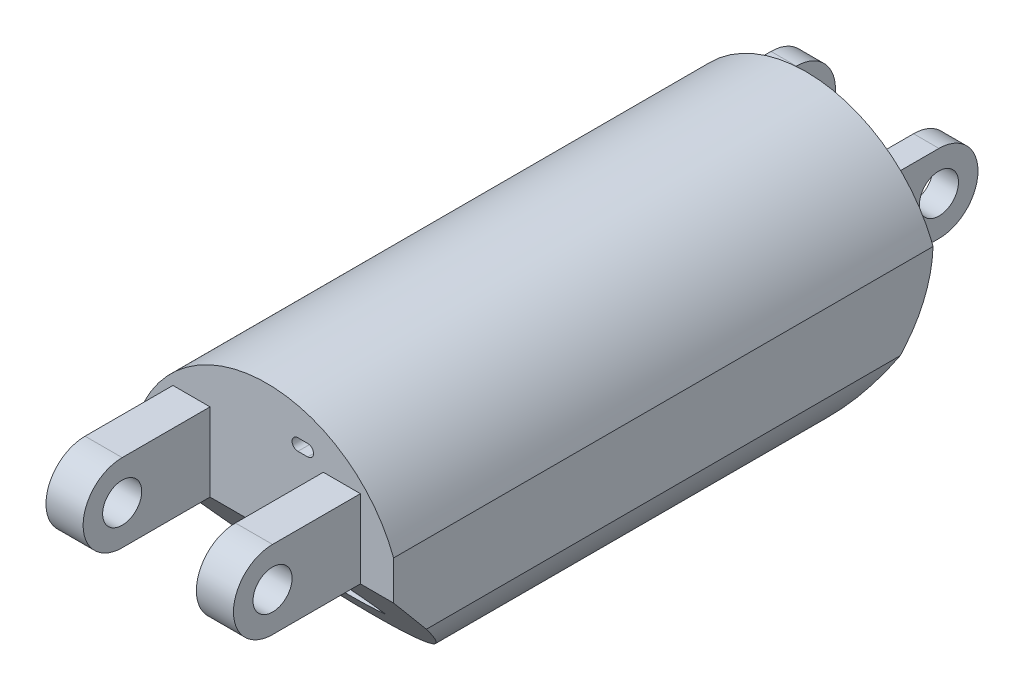
from build123d import *

# Parameters (mm, degrees)
BOSS_EXTRUDE1_DEPTH       = 17.541875
CUT_EXTRUDE1_DEPTH        = 27.39752836
CUT_EXTRUDE2_DEPTH        = 41.248995504
SKETCH4_R                 = 1.27
BOSS_EXTRUDE2_DEPTH       = 0.635
SKETCH5_R                 = 1.27
BOSS_EXTRUDE3_DEPTH       = 1.27
MIRROR2_COPY_1_SKETCH_R   = 1.27
MIRROR2_COPY_1_DEPTH      = 0.635
MIRROR2_COPY_2_SKETCH_R   = 1.27
MIRROR2_COPY_2_DEPTH      = 1.27
SKETCH6_R                 = 1.27
CUT_EXTRUDE3_DEPTH        = 0.635
SKETCH7_R                 = 1.27
BOSS_EXTRUDE4_DEPTH       = 0.381
MIRROR4_COPY_1_SKETCH_R   = 1.27
MIRROR4_COPY_1_DEPTH      = 0.635
MIRROR4_COPY_2_SKETCH_R   = 1.27
MIRROR4_COPY_2_DEPTH      = 0.381
BOSS_EXTRUDE8_DEPTH       = 2.286
BOSS_EXTRUDE9_START       = -2.286
BOSS_EXTRUDE9_DEPTH       = 2.286
CUT_EXTRUDE13_DEPTH       = 3.81
CUT_EXTRUDE13_DEPTH_BACK  = 3.81
SKETCH30_R                = 1.27
SKETCH31_R                = 1.27
BOSS_EXTRUDE17_DEPTH      = 1.27
CUT_EXTRUDE14_DEPTH       = 17.78
FILLET1_R                 = 7.62
BOSS_EXTRUDE18_DEPTH      = 6.096
BOSS_EXTRUDE18_DEPTH_BACK = 6.096
SKETCH33_R                = 1.27
SKETCH34_W                = 7.366
SKETCH34_H                = 5.915462339
CUT_EXTRUDE15_DEPTH       = 46.317216729
CUT_EXTRUDE16_DEPTH       = 32.431862668
CUT_EXTRUDE16_DEPTH_BACK  = 32.431862668
SKETCH35_R                = 1.27
SKETCH36_W                = 0.284935897
SKETCH36_H                = 2.320192308
CUT_EXTRUDE17_DEPTH       = 1
CUT_EXTRUDE18_DEPTH       = 22.86


with BuildPart() as part:
    # Sketch1 → Boss-Extrude1 (new, symmetric)
    with BuildSketch(Plane.XY):
        with BuildLine():
            Line((0, 0), (0, 5.08))
            ThreePointArc((0, 5.08), (8.255, 10.795), (16.51, 5.08))
            Line((16.51, 5.08), (16.51, 0))
            ThreePointArc((16.51, 0), (8.255, -5.715), (0, 0))
        make_face()
    extrude(amount=BOSS_EXTRUDE1_DEPTH, both=True)

    # Sketch2 → Cut-Extrude1 (cut, through all)
    with BuildSketch(Plane(origin=(0, 0, 0), x_dir=(0, 0, -1), z_dir=(1, 0, 0))):
        Polygon((17.541875, -5.715), (10.615107545, -5.715), (17.541875, 2.54), align=None)
        Polygon((-17.541875, 2.54), (-17.541875, -5.715), (-10.615107545, -5.715), align=None)
    extrude(amount=CUT_EXTRUDE1_DEPTH, mode=Mode.SUBTRACT)

    # Sketch3 → Cut-Extrude2 (cut, through all)
    with BuildSketch(Plane.XY.offset(17.541875)):
        with BuildLine():
            ThreePointArc((5.27906494, -2.991291811), (8.322471529, -3.631916692), (11.365878119, -2.991291811))
            ThreePointArc((11.365878119, -2.991291811), (8.322471529, -0.720891905), (5.27906494, -2.991291811))
        make_face()
    extrude(amount=-CUT_EXTRUDE2_DEPTH, mode=Mode.SUBTRACT)

    # Sketch4 → Boss-Extrude2 (add, symmetric)
    with BuildSketch(Plane(origin=(11.43, 0, 0), x_dir=(0, 0, -1), z_dir=(1, 0, 0))):
        with BuildLine():
            Line((-17.541875, 7.62), (-20.716875, 7.62))
            ThreePointArc((-20.716875, 7.62), (-23.256875, 5.08), (-20.716875, 2.54))
            Line((-20.716875, 2.54), (-17.541875, 2.54))
            Line((-17.541875, 2.54), (-17.541875, 7.62))
        make_face()
        with Locations((-20.716875, 5.08)):
            Circle(SKETCH4_R, mode=Mode.SUBTRACT)
    boss_extrude2 = extrude(amount=BOSS_EXTRUDE2_DEPTH, both=True)

    # Sketch5 → Boss-Extrude3 (add)
    with BuildSketch(Plane.ZY.offset(-10.795)):
        with BuildLine():
            Line((17.541875, 7.62), (17.541875, 2.54))
            Line((17.541875, 2.54), (20.716875, 2.54))
            ThreePointArc((20.716875, 2.54), (23.256875, 5.08), (20.716875, 7.62))
            Line((20.716875, 7.62), (17.541875, 7.62))
        make_face()
        with Locations((20.716875, 5.08)):
            Circle(SKETCH5_R, mode=Mode.SUBTRACT)
    boss_extrude3 = extrude(amount=BOSS_EXTRUDE3_DEPTH)

    # Mirror1: Boss-Extrude2, Boss-Extrude3 across plane
    add(boss_extrude2.mirror(Plane(origin=(8.255, 0, 0), x_dir=(0, 0, 1), z_dir=(1, 0, 0))))
    add(boss_extrude3.mirror(Plane(origin=(8.255, 0, 0), x_dir=(0, 0, 1), z_dir=(1, 0, 0))))

    # Mirror2: Boss-Extrude2, Boss-Extrude3 across plane
    add(boss_extrude2.mirror(Plane.XY))
    add(boss_extrude3.mirror(Plane.XY))

    # Mirror2 copy 1 sketch → Mirror2 copy 1 (add, symmetric)
    with BuildSketch(Plane.ZY.offset(-5.08)):
        with BuildLine():
            Line((-17.541875, 7.62), (-20.716875, 7.62))
            ThreePointArc((-20.716875, 7.62), (-23.256875, 5.08), (-20.716875, 2.54))
            Line((-20.716875, 2.54), (-17.541875, 2.54))
            Line((-17.541875, 2.54), (-17.541875, 7.62))
        make_face()
        with Locations((-20.716875, 5.08)):
            Circle(MIRROR2_COPY_1_SKETCH_R, mode=Mode.SUBTRACT)
    extrude(amount=MIRROR2_COPY_1_DEPTH, both=True)

    # Mirror2 copy 2 sketch → Mirror2 copy 2 (add)
    with BuildSketch(Plane(origin=(5.715, 0, 0), x_dir=(0, 0, -1), z_dir=(1, 0, 0))):
        with BuildLine():
            Line((17.541875, 7.62), (17.541875, 2.54))
            Line((17.541875, 2.54), (20.716875, 2.54))
            ThreePointArc((20.716875, 2.54), (23.256875, 5.08), (20.716875, 7.62))
            Line((20.716875, 7.62), (17.541875, 7.62))
        make_face()
        with Locations((20.716875, 5.08)):
            Circle(MIRROR2_COPY_2_SKETCH_R, mode=Mode.SUBTRACT)
    extrude(amount=MIRROR2_COPY_2_DEPTH)

    # Sketch6 → Cut-Extrude3 (cut)
    with BuildSketch(Plane.ZY.offset(-9.525)):
        with BuildLine():
            Line((20.716875, 7.62), (17.541875, 7.62))
            Line((17.541875, 7.62), (17.541875, 2.54))
            Line((17.541875, 2.54), (20.716875, 2.54))
            ThreePointArc((20.716875, 2.54), (23.256875, 5.08), (20.716875, 7.62))
        make_face()
        with Locations((20.716875, 5.08)):
            Circle(SKETCH6_R, mode=Mode.SUBTRACT)
    cut_extrude3 = extrude(amount=-CUT_EXTRUDE3_DEPTH, mode=Mode.SUBTRACT)

    # Sketch7 → Boss-Extrude4 (add)
    with BuildSketch(Plane(origin=(12.065, 0, 0), x_dir=(0, 0, -1), z_dir=(1, 0, 0))):
        with BuildLine():
            Line((-17.541875, 2.54), (-17.541875, 7.62))
            Line((-17.541875, 7.62), (-20.716875, 7.62))
            ThreePointArc((-20.716875, 7.62), (-23.256875, 5.08), (-20.716875, 2.54))
            Line((-20.716875, 2.54), (-17.541875, 2.54))
        make_face()
        with Locations(Location((-20.716875, 5.08, 0), (0, 0, 180))):
            Circle(SKETCH7_R, mode=Mode.SUBTRACT)
    boss_extrude4 = extrude(amount=BOSS_EXTRUDE4_DEPTH)

    # Mirror3: Cut-Extrude3, Boss-Extrude4 across plane
    add(cut_extrude3.mirror(Plane(origin=(8.255, 0, 0), x_dir=(0, 0, 1), z_dir=(1, 0, 0))), mode=Mode.SUBTRACT)
    add(boss_extrude4.mirror(Plane(origin=(8.255, 0, 0), x_dir=(0, 0, 1), z_dir=(1, 0, 0))))

    # Mirror4: Cut-Extrude3, Boss-Extrude4 across plane
    add(cut_extrude3.mirror(Plane.XY), mode=Mode.SUBTRACT)
    add(boss_extrude4.mirror(Plane.XY))

    # Mirror4 copy 1 sketch → Mirror4 copy 1 (cut)
    with BuildSketch(Plane(origin=(6.985, 0, 0), x_dir=(0, 0, -1), z_dir=(1, 0, 0))):
        with BuildLine():
            Line((20.716875, 7.62), (17.541875, 7.62))
            Line((17.541875, 7.62), (17.541875, 2.54))
            Line((17.541875, 2.54), (20.716875, 2.54))
            ThreePointArc((20.716875, 2.54), (23.256875, 5.08), (20.716875, 7.62))
        make_face()
        with Locations((20.716875, 5.08)):
            Circle(MIRROR4_COPY_1_SKETCH_R, mode=Mode.SUBTRACT)
    extrude(amount=-MIRROR4_COPY_1_DEPTH, mode=Mode.SUBTRACT)

    # Mirror4 copy 2 sketch → Mirror4 copy 2 (add)
    with BuildSketch(Plane.ZY.offset(-4.445)):
        with BuildLine():
            Line((-17.541875, 2.54), (-17.541875, 7.62))
            Line((-17.541875, 7.62), (-20.716875, 7.62))
            ThreePointArc((-20.716875, 7.62), (-23.256875, 5.08), (-20.716875, 2.54))
            Line((-20.716875, 2.54), (-17.541875, 2.54))
        make_face()
        with Locations(Location((-20.716875, 5.08, 0), (0, 0, 180))):
            Circle(MIRROR4_COPY_2_SKETCH_R, mode=Mode.SUBTRACT)
    extrude(amount=MIRROR4_COPY_2_DEPTH)

    # Sketch13 → Boss-Extrude8 (add)
    with BuildSketch(Plane(origin=(12.446, 0, 0), x_dir=(0, 0, -1), z_dir=(1, 0, 0))):
        with BuildLine():
            Line((-17.541875, 7.62), (-23.256875, 7.62))
            ThreePointArc((-23.256875, 7.62), (-25.796875, 5.08), (-23.256875, 2.54))
            Line((-23.256875, 2.54), (-17.541875, 2.54))
            Line((-17.541875, 2.54), (-17.541875, 7.62))
        make_face()
    extrude(amount=-BOSS_EXTRUDE8_DEPTH)

    # Sketch14 → Boss-Extrude9 (add)
    with BuildSketch(Plane.ZY.offset(-4.064).offset(BOSS_EXTRUDE9_START)):
        with BuildLine():
            Line((17.541875, 7.62), (17.541875, 2.54))
            Line((17.541875, 2.54), (23.256875, 2.54))
            ThreePointArc((23.256875, 2.54), (25.796875, 5.08), (23.256875, 7.62))
            Line((23.256875, 7.62), (17.541875, 7.62))
        make_face()
    extrude(amount=BOSS_EXTRUDE9_DEPTH)

    # Sketch30 → Cut-Extrude13 (cut, two sides: drawn at the far end of the back side and taken through both)
    with BuildSketch(Plane(origin=(8.255, 0, 0), x_dir=(0, 0, -1), z_dir=(1, 0, 0)).offset(-CUT_EXTRUDE13_DEPTH_BACK)):
        with BuildLine():
            Line((17.541875, 2.54), (20.716875, 2.54))
            ThreePointArc((20.716875, 2.54), (23.256875, 5.08), (20.716875, 7.62))
            Line((20.716875, 7.62), (17.541875, 7.62))
            Line((17.541875, 7.62), (17.541875, 2.54))
        make_face()
        with Locations((20.716875, 5.08)):
            Circle(SKETCH30_R, mode=Mode.SUBTRACT)
    extrude(amount=CUT_EXTRUDE13_DEPTH + CUT_EXTRUDE13_DEPTH_BACK, mode=Mode.SUBTRACT)

    # Sketch31 → Boss-Extrude17 (add)
    with BuildSketch(Plane(origin=(12.446, 0, 0), x_dir=(0, 0, -1), z_dir=(1, 0, 0))):
        with BuildLine():
            Line((17.541875, 2.54), (20.716875, 2.54))
            ThreePointArc((20.716875, 2.54), (23.256875, 5.08), (20.716875, 7.62))
            Line((20.716875, 7.62), (17.541875, 7.62))
            Line((17.541875, 7.62), (17.541875, 2.54))
        make_face()
        with Locations((20.716875, 5.08)):
            Circle(SKETCH31_R, mode=Mode.SUBTRACT)
    boss_extrude17 = extrude(amount=BOSS_EXTRUDE17_DEPTH)

    # Mirror11: Boss-Extrude17 across plane
    add(boss_extrude17.mirror(Plane(origin=(8.255, 0, 0), x_dir=(0, 0, 1), z_dir=(1, 0, 0))))

    # Sketch32 → Cut-Extrude14 (cut)
    with BuildSketch(Plane(origin=(0, 0, -17.541875), x_dir=(-1, 0, 0), z_dir=(0, 0, -1))):
        with BuildLine():
            Line((-6.223, 7.9756), (-5.588, 7.9756))
            ThreePointArc((-5.588, 7.9756), (-5.207, 8.3566), (-5.588, 8.7376))
            Line((-5.588, 8.7376), (-6.223, 8.7376))
            ThreePointArc((-6.223, 8.7376), (-6.604, 8.3566), (-6.223, 7.9756))
        make_face()
    extrude(amount=-CUT_EXTRUDE14_DEPTH, mode=Mode.SUBTRACT)

    # Fillet1
    fillet1_edges = [part.edges().sort_by_distance(p)[0] for p in [
        (1.397, 2.54, -17.541875),
        (15.113, 2.54, -17.541875),
    ]]
    fillet(fillet1_edges, radius=FILLET1_R)

    # Sketch33 → Boss-Extrude18 (add, two sides: drawn at the far end of the back side and taken through both)
    with BuildSketch(Plane(origin=(8.255, 0, 0), x_dir=(0, 0, -1), z_dir=(1, 0, 0)).offset(-BOSS_EXTRUDE18_DEPTH_BACK)):
        with BuildLine():
            Line((-23.256875, 2.54), (-17.541875, 2.54))
            Line((-17.541875, 2.54), (-17.541875, 7.62))
            Line((-17.541875, 7.62), (-23.256875, 7.62))
            ThreePointArc((-23.256875, 7.62), (-25.796875, 5.08), (-23.256875, 2.54))
        make_face()
        with Locations(Location((-23.256875, 5.08, 0), (0, 0, 180))):
            Circle(SKETCH33_R, mode=Mode.SUBTRACT)
    extrude(amount=BOSS_EXTRUDE18_DEPTH + BOSS_EXTRUDE18_DEPTH_BACK)

    # Sketch34 → Cut-Extrude15 (cut, through all)
    with BuildSketch(Plane.XY.offset(17.541875)):
        with Locations((8.255, 4.662268831)):
            Rectangle(SKETCH34_W, SKETCH34_H)
    extrude(amount=CUT_EXTRUDE15_DEPTH, mode=Mode.SUBTRACT)

    # Sketch35 → Cut-Extrude16 (cut, two sides: drawn at the far end of the back side and taken through both)
    with BuildSketch(Plane(origin=(14.351, 0, 0), x_dir=(0, 0, -1), z_dir=(1, 0, 0)).offset(-CUT_EXTRUDE16_DEPTH_BACK)):
        with Locations(Location((-23.256875, 5.08, 0), (0, 0, 180))):
            Circle(SKETCH35_R)
    extrude(amount=CUT_EXTRUDE16_DEPTH + CUT_EXTRUDE16_DEPTH_BACK, mode=Mode.SUBTRACT)

    # Sketch36 → Cut-Extrude17 (cut)
    # profile 1 of 6: a face of its own
    with BuildSketch(Plane.ZY):
        with BuildLine():
            Line((-6.045949739, 4.251163205), (-5.410568129, 4.251163205))
            add(Edge.make_bspline(
                [(-5.410568129, 4.251163205), (-5.368167248, 4.251022066), (-5.28675286, 4.250751064), (-5.170118536, 4.249239979), (-5.064139669, 4.244908957), (-4.968871672, 4.241181885), (-4.884316292, 4.234385624), (-4.81021425, 4.227889894), (-4.746906839, 4.219386644), (-4.708583817, 4.211489582), (-4.691232191, 4.207914006)],
                knots=[0, 0, 0, 0, 1.410062039, 2.707475311, 3.878576406, 4.937260626, 5.877586885, 6.699081471, 7.410979367, 8, 8, 8, 8], degree=3))
            add(Edge.make_bspline(
                [(-4.691232191, 4.207914006), (-4.668003325, 4.202174726), (-4.622041128, 4.190818601), (-4.555864996, 4.166815963), (-4.492805574, 4.139039589), (-4.433124805, 4.106415357), (-4.377121623, 4.068701093), (-4.324218583, 4.026547867), (-4.274175627, 3.980186331), (-4.229016577, 3.928447582), (-4.186436152, 3.874167319), (-4.150523612, 3.815471768), (-4.11956602, 3.754093097), (-4.094918479, 3.689407082), (-4.075072032, 3.622041046), (-4.061078229, 3.551384781), (-4.05268608, 3.477760182), (-4.051831683, 3.42754265), (-4.051398457, 3.402079671)],
                knots=[0, 0, 0, 0, 1.027469482, 2.033020251, 3.019912614, 3.986113645, 4.951240523, 5.91722682, 6.890402269, 7.87763091, 8.8651537, 9.85103654, 10.82876324, 11.815024772, 12.821070561, 13.842952187, 14.906261191, 16, 16, 16, 16], degree=3))
            add(Edge.make_bspline(
                [(-4.051398457, 3.402079671), (-4.052731048, 3.359774969), (-4.055331279, 3.277227539), (-4.079574766, 3.157429453), (-4.119286323, 3.045679146), (-4.174008164, 2.942117325), (-4.243694402, 2.848762668), (-4.327446177, 2.766765612), (-4.425310211, 2.698149406), (-4.516413947, 2.650567219), (-4.5968904, 2.620093651), (-4.663142048, 2.598652097), (-4.735411377, 2.582085886), (-4.813005959, 2.567244909), (-4.896248704, 2.556040158), (-4.984940097, 2.547833604), (-5.079143392, 2.542704575), (-5.143858119, 2.541940756), (-5.177149659, 2.54154782)],
                knots=[0, 0, 0, 0, 1.260483769, 2.459530307, 3.627416485, 4.787058657, 5.939039949, 7.08810263, 8.267026773, 9.491475466, 10.141966685, 10.831826277, 11.566392101, 12.351337768, 13.187381173, 14.07005841, 15.007169909, 16, 16, 16, 16], degree=3))
            Line((-5.177149659, 2.54154782), (-4.010693329, 1.076163205))
            Line((-4.010693329, 1.076163205), (-4.363047095, 1.076163205))
            Line((-4.363047095, 1.076163205), (-5.529503425, 2.54154782))
            Line((-5.529503425, 2.54154782), (-5.761013842, 2.54154782))
            Line((-5.761013842, 2.54154782), (-5.761013842, 1.076163205))
            Line((-5.761013842, 1.076163205), (-6.045949739, 1.076163205))
            Line((-6.045949739, 1.076163205), (-6.045949739, 4.251163205))
        make_face()
        with BuildLine():
            Line((-5.761013842, 3.925522179), (-5.761013842, 2.867188846))
            Line((-5.761013842, 2.867188846), (-5.17969373, 2.862736723))
            add(Edge.make_bspline(
                [(-5.17969373, 2.862736723), (-5.15255198, 2.862724715), (-5.099943539, 2.862701441), (-5.02383365, 2.866324367), (-4.952967549, 2.870445805), (-4.887616295, 2.876749855), (-4.827750695, 2.884874291), (-4.77340067, 2.895036998), (-4.724477501, 2.906877084), (-4.667419542, 2.925202844), (-4.603704974, 2.954236875), (-4.534461435, 2.996478435), (-4.475495029, 3.049608993), (-4.425676682, 3.110363485), (-4.385644984, 3.177162082), (-4.357421906, 3.249204074), (-4.33951269, 3.324670738), (-4.337400367, 3.37653945), (-4.336334355, 3.402715689)],
                knots=[0, 0, 0, 0, 1.146690395, 2.22261258, 3.21895312, 4.145990853, 4.996080663, 5.770904154, 6.481378293, 7.121626537, 8.300444488, 9.431385265, 10.535395872, 11.636531494, 12.74115979, 13.810798291, 14.895190096, 16, 16, 16, 16], degree=3))
            add(Edge.make_bspline(
                [(-4.336334355, 3.402715689), (-4.33742485, 3.428248652), (-4.339585815, 3.478845669), (-4.357228626, 3.552919245), (-4.387063993, 3.622829978), (-4.427270595, 3.688293475), (-4.476255543, 3.747716535), (-4.533693844, 3.79855931), (-4.598014986, 3.840514182), (-4.65813243, 3.867324227), (-4.711866323, 3.883761522), (-4.758520371, 3.895328649), (-4.811235783, 3.904621846), (-4.870268521, 3.91206773), (-4.935366571, 3.918467572), (-5.006859091, 3.922778114), (-5.084271741, 3.925330691), (-5.137926457, 3.925456865), (-5.165701342, 3.925522179)],
                knots=[0, 0, 0, 0, 1.101028733, 2.181837193, 3.264309656, 4.369019818, 5.486613113, 6.575447106, 7.666700264, 8.788928104, 9.402425223, 10.0903467, 10.862060571, 11.710948788, 12.657782767, 13.684531032, 14.801375019, 16, 16, 16, 16], degree=3))
            Line((-5.165701342, 3.925522179), (-5.761013842, 3.925522179))
        make_face(mode=Mode.SUBTRACT)
    # profile 2 of 6: a face of its own
    with BuildSketch(Plane.ZY):
        with BuildLine():
            add(Edge.make_bspline(
                [(-3.340330749, 4.37327859), (-3.322649341, 4.372458394), (-3.288025749, 4.370852294), (-3.23795757, 4.357098669), (-3.19236728, 4.333785382), (-3.151928909, 4.302507386), (-3.117228983, 4.265723248), (-3.092935053, 4.222850798), (-3.07732095, 4.176533319), (-3.075435404, 4.144225345), (-3.07447538, 4.127775785)],
                knots=[0, 0, 0, 0, 1.055194115, 2.066272739, 3.074728998, 4.095836921, 5.109056067, 6.073838105, 7.019297344, 8, 8, 8, 8], degree=3))
            add(Edge.make_bspline(
                [(-3.07447538, 4.127775785), (-3.075457054, 4.111753236), (-3.077397706, 4.080078551), (-3.092922992, 4.034564044), (-3.117436022, 3.992287301), (-3.151906658, 3.955574586), (-3.192373177, 3.92431388), (-3.237956004, 3.90099601), (-3.288026161, 3.8872436), (-3.32264948, 3.885637332), (-3.340330749, 3.884817051)],
                knots=[0, 0, 0, 0, 0.96129708, 1.900370562, 2.859976407, 3.87933698, 4.906634145, 5.921202961, 6.938410037, 8, 8, 8, 8], degree=3))
            add(Edge.make_bspline(
                [(-3.340330749, 3.884817051), (-3.357809827, 3.885606012), (-3.391830569, 3.88714162), (-3.441149062, 3.901265851), (-3.48635062, 3.92432186), (-3.526867859, 3.955369899), (-3.560640963, 3.99251277), (-3.585223015, 4.034538244), (-3.600712445, 4.08008512), (-3.602657929, 4.111755442), (-3.603642047, 4.127775785)],
                knots=[0, 0, 0, 0, 1.054934014, 2.053291228, 3.073705704, 4.106921865, 5.123545215, 6.088680038, 7.033164197, 8, 8, 8, 8], degree=3))
            add(Edge.make_bspline(
                [(-3.603642047, 4.127775785), (-3.60267949, 4.144223056), (-3.600788967, 4.176526533), (-3.585211404, 4.222877028), (-3.560845722, 4.265495961), (-3.526845496, 4.30271195), (-3.486356572, 4.333777452), (-3.441147524, 4.356828842), (-3.391830975, 4.370954271), (-3.357809965, 4.372489714), (-3.340330749, 4.37327859)],
                knots=[0, 0, 0, 0, 0.98631895, 1.937192651, 2.907499808, 3.917963147, 4.944918757, 5.95915025, 6.951458133, 8, 8, 8, 8], degree=3))
        make_face()
    # profile 3 of 6: a face of its own
    with BuildSketch(Plane.ZY):
        with Locations((-3.339058714, 2.236259359)):
            Rectangle(SKETCH36_W, SKETCH36_H)
    # profile 4 of 6: a face of its own
    with BuildSketch(Plane.ZY):
        with BuildLine():
            Line((-2.504603586, 3.396355513), (-2.219667688, 3.396355513))
            Line((-2.219667688, 3.396355513), (-2.219667688, 2.977855913))
            add(Edge.make_bspline(
                [(-2.219667688, 2.977855913), (-2.189244262, 3.015813241), (-2.130206542, 3.089470758), (-2.031886468, 3.186281565), (-1.927978787, 3.266060448), (-1.819119827, 3.329654604), (-1.705161811, 3.377594043), (-1.58679938, 3.412215995), (-1.463323897, 3.432975804), (-1.379354729, 3.43568837), (-1.33687522, 3.437060641)],
                knots=[0, 0, 0, 0, 1.12780773, 2.188550248, 3.19190651, 4.159438251, 5.104880172, 6.052711206, 7.014878035, 8, 8, 8, 8], degree=3))
            add(Edge.make_bspline(
                [(-1.33687522, 3.437060641), (-1.293939574, 3.435477499), (-1.209904156, 3.432378909), (-1.087550486, 3.407870911), (-0.973274622, 3.366010573), (-0.867484025, 3.308668194), (-0.772118624, 3.237360893), (-0.688366795, 3.154286763), (-0.61909442, 3.058731887), (-0.572651098, 2.970083024), (-0.542057118, 2.891443904), (-0.522796355, 2.824091495), (-0.506439678, 2.749054315), (-0.49225945, 2.666559116), (-0.482664498, 2.576027901), (-0.475096848, 2.47783178), (-0.469673318, 2.372002562), (-0.469458138, 2.298808264), (-0.469347175, 2.261064046)],
                knots=[0, 0, 0, 0, 1.235846778, 2.418850247, 3.575807741, 4.728682307, 5.871620074, 6.994088408, 8.11269785, 9.256955736, 9.865816715, 10.540099792, 11.271859618, 12.076849838, 12.949306005, 13.892391288, 14.913166135, 16, 16, 16, 16], degree=3))
            Line((-0.469347175, 2.261064046), (-0.469347175, 1.076163205))
            Line((-0.469347175, 1.076163205), (-0.754283073, 1.076163205))
            Line((-0.754283073, 1.076163205), (-0.754283073, 2.167569455))
            add(Edge.make_bspline(
                [(-0.754283073, 2.167569455), (-0.75445834, 2.199158387), (-0.754793596, 2.259582638), (-0.755851005, 2.346095967), (-0.758399901, 2.424551648), (-0.761981584, 2.494762117), (-0.767223991, 2.556659955), (-0.772687378, 2.610371227), (-0.779368464, 2.655827741), (-0.785321964, 2.68319178), (-0.787992007, 2.695464086)],
                knots=[0, 0, 0, 0, 1.430800155, 2.736877192, 3.918605307, 4.986035426, 5.920637409, 6.731861385, 7.431261377, 8, 8, 8, 8], degree=3))
            add(Edge.make_bspline(
                [(-0.787992007, 2.695464086), (-0.797630882, 2.731487804), (-0.816182734, 2.800822315), (-0.862024276, 2.894869764), (-0.919912854, 2.97487812), (-0.990577332, 3.040352717), (-1.073335136, 3.091307691), (-1.167956616, 3.126662635), (-1.273528668, 3.148775394), (-1.347782287, 3.150977149), (-1.386484595, 3.152124744)],
                knots=[0, 0, 0, 0, 1.084156227, 2.086665306, 3.027808233, 3.945421172, 4.874247719, 5.839848303, 6.874090471, 8, 8, 8, 8], degree=3))
            add(Edge.make_bspline(
                [(-1.386484595, 3.152124744), (-1.409405994, 3.151692939), (-1.45476685, 3.15083841), (-1.522031467, 3.142264732), (-1.587276967, 3.128241705), (-1.651158157, 3.109310869), (-1.712397369, 3.083310097), (-1.772962119, 3.053801311), (-1.830571827, 3.01701829), (-1.886454908, 2.97602394), (-1.938445813, 2.930594945), (-1.986822234, 2.882657425), (-2.029946009, 2.831607413), (-2.06901545, 2.778267461), (-2.102741447, 2.721905008), (-2.132181034, 2.663063816), (-2.157159842, 2.601666438), (-2.169571999, 2.559053347), (-2.175782472, 2.537731715)],
                knots=[0, 0, 0, 0, 1.023777757, 2.026029729, 3.023749952, 4.003683103, 4.997618607, 5.993177895, 7.010360494, 8.046726602, 9.087585522, 10.09234134, 11.086953743, 12.070360549, 13.043493632, 14.017870808, 15.008233677, 16, 16, 16, 16], degree=3))
            add(Edge.make_bspline(
                [(-2.175782472, 2.537731715), (-2.179356296, 2.522078781), (-2.187136324, 2.488003162), (-2.195539351, 2.432082867), (-2.203166223, 2.367394532), (-2.20954975, 2.294013645), (-2.213455378, 2.211683287), (-2.217713866, 2.120755062), (-2.219264229, 2.020866398), (-2.219529436, 1.951323291), (-2.219667688, 1.915070457)],
                knots=[0, 0, 0, 0, 0.615963638, 1.340920617, 2.168419149, 3.115676021, 4.16674242, 5.331190069, 6.6087489, 8, 8, 8, 8], degree=3))
            Line((-2.219667688, 1.915070457), (-2.219667688, 1.076163205))
            Line((-2.219667688, 1.076163205), (-2.504603586, 1.076163205))
            Line((-2.504603586, 1.076163205), (-2.504603586, 3.396355513))
        make_face()
    # profile 5 of 6: a face of its own
    with BuildSketch(Plane.ZY):
        with BuildLine():
            Line((2.217191286, 3.396355513), (2.502127184, 3.396355513))
            Line((2.502127184, 3.396355513), (2.502127184, 1.555084479))
            add(Edge.make_bspline(
                [(2.502127184, 1.555084479), (2.501875866, 1.515861804), (2.501390764, 1.440152593), (2.497897383, 1.330680154), (2.490530768, 1.22956449), (2.482177179, 1.136344442), (2.470160515, 1.051452099), (2.455486239, 0.974634149), (2.438943873, 0.905816874), (2.424411247, 0.863430769), (2.417536839, 0.843380753)],
                knots=[0, 0, 0, 0, 1.307562039, 2.523909702, 3.650326591, 4.686913197, 5.643429486, 6.506965704, 7.293745905, 8, 8, 8, 8], degree=3))
            add(Edge.make_bspline(
                [(2.417536839, 0.843380753), (2.407386601, 0.81731861), (2.387389611, 0.765973565), (2.349937643, 0.693189574), (2.307996888, 0.624658206), (2.260093621, 0.560761375), (2.206444463, 0.501819848), (2.148313395, 0.446553077), (2.084568293, 0.396130296), (2.015245604, 0.351421491), (1.941943351, 0.311156092), (1.864703673, 0.276279563), (1.783962118, 0.245902212), (1.698960209, 0.223148533), (1.611030639, 0.203432036), (1.519139398, 0.190600786), (1.423823361, 0.181867669), (1.359012195, 0.1810601), (1.326130589, 0.180650385)],
                knots=[0, 0, 0, 0, 0.981931301, 1.934503488, 2.87077864, 3.801706999, 4.735015492, 5.667491629, 6.616593066, 7.585388521, 8.561939025, 9.551802639, 10.560317337, 11.588439944, 12.640189604, 13.723962949, 14.845264515, 16, 16, 16, 16], degree=3))
            add(Edge.make_bspline(
                [(1.326130589, 0.180650385), (1.27815658, 0.18142734), (1.184450451, 0.182944941), (1.047830207, 0.200625986), (0.918077283, 0.225621739), (0.796906168, 0.263454519), (0.685082581, 0.30975236), (0.583370208, 0.362906353), (0.492682132, 0.423856655), (0.410927085, 0.493253628), (0.337138643, 0.575770682), (0.267717459, 0.673015348), (0.200896461, 0.786468883), (0.16173634, 0.869737987), (0.141229748, 0.913342692)],
                knots=[0, 0, 0, 0, 1.157897085, 2.2616841, 3.32207898, 4.345638746, 5.321241055, 6.241986252, 7.112515963, 7.955008012, 8.825025602, 9.77857164, 10.836726669, 12, 12, 12, 12], degree=3))
            Line((0.141229748, 0.913342692), (0.426165645, 0.913342692))
            add(Edge.make_bspline(
                [(0.426165645, 0.913342692), (0.449082078, 0.876960934), (0.493880882, 0.805839075), (0.577654147, 0.713752141), (0.669462743, 0.635054446), (0.772405027, 0.571635386), (0.886909329, 0.523820076), (1.013044538, 0.489733914), (1.151837052, 0.469326586), (1.248464289, 0.466867055), (1.298781831, 0.465586282)],
                knots=[0, 0, 0, 0, 0.997731894, 1.950442991, 2.880492273, 3.800895997, 4.748200782, 5.754801363, 6.83083817, 8, 8, 8, 8], degree=3))
            add(Edge.make_bspline(
                [(1.298781831, 0.465586282), (1.348463224, 0.466883631), (1.444243978, 0.469384791), (1.581976539, 0.489743022), (1.707701947, 0.523827494), (1.820695843, 0.571550815), (1.919625004, 0.630016541), (2.004907311, 0.695330895), (2.07398141, 0.768973662), (2.120438887, 0.836811443), (2.149317433, 0.897249046), (2.167707247, 0.949276044), (2.182651491, 1.008106869), (2.195151772, 1.073544287), (2.205466815, 1.14568179), (2.212000859, 1.22468432), (2.216723273, 1.310372329), (2.217031675, 1.369783961), (2.217191286, 1.400532195)],
                knots=[0, 0, 0, 0, 1.570740765, 3.028230971, 4.391408896, 5.680370741, 6.894727393, 8.017376726, 9.065722033, 10.075533815, 10.603371122, 11.180248986, 11.817768598, 12.521299649, 13.286540596, 14.121245857, 15.027658897, 16, 16, 16, 16], degree=3))
            Line((2.217191286, 1.400532195), (2.217191286, 1.520739527))
            add(Edge.make_bspline(
                [(2.217191286, 1.520739527), (2.188270558, 1.486320892), (2.130937809, 1.418089036), (2.031925591, 1.328679551), (1.923778818, 1.251675705), (1.806681604, 1.188521657), (1.68350227, 1.138010651), (1.555574961, 1.102683822), (1.424046454, 1.079860199), (1.334917718, 1.077404276), (1.289877584, 1.076163205)],
                knots=[0, 0, 0, 0, 1.012485704, 2.007162095, 2.997754123, 3.998611389, 4.999708251, 5.992315798, 6.98544096, 8, 8, 8, 8], degree=3))
            add(Edge.make_bspline(
                [(1.289877584, 1.076163205), (1.263356111, 1.076630408), (1.21062702, 1.077559284), (1.132290928, 1.085686175), (1.055110816, 1.097477891), (0.979266685, 1.114787482), (0.904649093, 1.137004977), (0.831381349, 1.164778733), (0.758870221, 1.19617959), (0.688433755, 1.233166348), (0.620773479, 1.27431644), (0.556399733, 1.318892434), (0.495649701, 1.366661024), (0.4391016, 1.418093248), (0.386829605, 1.473114667), (0.338130667, 1.531138747), (0.293810074, 1.59297572), (0.252958357, 1.657498031), (0.217527579, 1.725135441), (0.186426756, 1.794421284), (0.159385367, 1.865207414), (0.137826752, 1.937730821), (0.1213611, 2.011945783), (0.109105394, 2.087730719), (0.10215402, 2.165318999), (0.101070053, 2.217589794), (0.10052462, 2.24389157)],
                knots=[0, 0, 0, 0, 1.028754217, 2.045334182, 3.052854819, 4.056607503, 5.061168794, 6.071104265, 7.095078842, 8.125279047, 9.155117945, 10.165957491, 11.161587969, 12.151493252, 13.128948131, 14.104219989, 15.088194871, 16.07871515, 17.064853787, 18.047899887, 19.02414258, 20.002704429, 20.980574569, 21.971845993, 22.979467364, 24, 24, 24, 24], degree=3))
            add(Edge.make_bspline(
                [(0.10052462, 2.24389157), (0.100995578, 2.270201522), (0.101935669, 2.322719522), (0.110055486, 2.400624393), (0.121638058, 2.477486095), (0.139969392, 2.552512381), (0.162033394, 2.626557692), (0.189359778, 2.699075106), (0.222215367, 2.77008671), (0.259417068, 2.839645092), (0.301221924, 2.906816857), (0.347062103, 2.970613172), (0.396992946, 3.030564585), (0.450325612, 3.08727591), (0.507711303, 3.140199979), (0.569120332, 3.18920834), (0.633947373, 3.235122493), (0.702393343, 3.276952063), (0.773402117, 3.313947386), (0.845169652, 3.347704528), (0.918646622, 3.374496194), (0.99246314, 3.398102862), (1.067919205, 3.414826218), (1.144089627, 3.427727823), (1.221235176, 3.435587963), (1.272899588, 3.436569115), (1.298781831, 3.437060641)],
                knots=[0, 0, 0, 0, 1.008818848, 2.013730394, 3.001654427, 3.987803273, 4.973046549, 5.963777569, 6.957074694, 7.972068341, 8.987420212, 9.989399531, 10.982630087, 11.977756091, 12.973280677, 13.973972381, 14.989194003, 16.018387222, 17.047741039, 18.059210846, 19.057554164, 20.045176975, 21.029480261, 22.018708529, 23.007435371, 24, 24, 24, 24], degree=3))
            add(Edge.make_bspline(
                [(1.298781831, 3.437060641), (1.341463754, 3.435829945), (1.425747438, 3.433399697), (1.54978199, 3.414330515), (1.669472451, 3.383928517), (1.785494222, 3.340371481), (1.89879242, 3.280908232), (2.008993636, 3.202582844), (2.116416707, 3.10469275), (2.182708739, 3.02962408), (2.217191286, 2.990576266)],
                knots=[0, 0, 0, 0, 0.96728863, 1.910097829, 2.838038873, 3.762875196, 4.71315279, 5.730631239, 6.819562287, 8, 8, 8, 8], degree=3))
            Line((2.217191286, 2.990576266), (2.217191286, 3.396355513))
        make_face()
        with BuildLine():
            add(Edge.make_bspline(
                [(1.321678466, 3.152124744), (1.280012756, 3.150708634), (1.197523485, 3.147905038), (1.076611917, 3.123970334), (0.959883556, 3.086463696), (0.849570061, 3.032812895), (0.746240039, 2.967413122), (0.654550738, 2.888183004), (0.57435485, 2.797698954), (0.506516042, 2.696779087), (0.452512588, 2.587901737), (0.414282486, 2.473138428), (0.389562822, 2.354343542), (0.386834452, 2.273269823), (0.385460517, 2.232443253)],
                knots=[0, 0, 0, 0, 1.026226791, 2.031711442, 3.026614839, 4.04107745, 5.047145931, 6.032893242, 7.017642609, 8.019221815, 9.021877557, 10.003543541, 10.994637589, 12, 12, 12, 12], degree=3))
            add(Edge.make_bspline(
                [(0.385460517, 2.232443253), (0.386118882, 2.201660927), (0.387413694, 2.141121094), (0.399862939, 2.052277433), (0.419984243, 1.967658862), (0.448502281, 1.887260265), (0.48383794, 1.810620487), (0.528281019, 1.738267467), (0.580578686, 1.67013677), (0.640321607, 1.606732308), (0.706158753, 1.548982715), (0.777568313, 1.498238921), (0.854453432, 1.456736482), (0.934923181, 1.420867293), (1.020930081, 1.394669853), (1.111235324, 1.374677532), (1.206477791, 1.363239588), (1.271403583, 1.361821907), (1.30450599, 1.361099103)],
                knots=[0, 0, 0, 0, 1.039728707, 2.044842319, 3.024901384, 3.974314358, 4.923051295, 5.871625912, 6.837440708, 7.820715446, 8.810779094, 9.792721783, 10.773906224, 11.758876063, 12.764959493, 13.806266761, 14.881525401, 16, 16, 16, 16], degree=3))
            add(Edge.make_bspline(
                [(1.30450599, 1.361099103), (1.338037399, 1.361795434), (1.403607714, 1.363157102), (1.499375635, 1.374862418), (1.590119621, 1.393750925), (1.675756467, 1.420568812), (1.756609512, 1.454787829), (1.831770484, 1.498091761), (1.902850976, 1.547408067), (1.967581434, 1.604931823), (2.026114069, 1.668327497), (2.077123408, 1.73731108), (2.120588658, 1.810844551), (2.156581973, 1.88891962), (2.184060422, 1.972143041), (2.202492572, 2.060306763), (2.215380119, 2.152988405), (2.216578387, 2.216496221), (2.217191286, 2.248979711)],
                knots=[0, 0, 0, 0, 1.121943988, 2.193949579, 3.223793937, 4.220241907, 5.192961521, 6.155822191, 7.11847367, 8.083710714, 9.04790392, 10.001595906, 10.949595423, 11.902125208, 12.873731292, 13.87582262, 14.913508608, 16, 16, 16, 16], degree=3))
            add(Edge.make_bspline(
                [(2.217191286, 2.248979711), (2.215976107, 2.291268765), (2.213602072, 2.373886714), (2.191198222, 2.494270711), (2.155075603, 2.607453722), (2.104414621, 2.713077786), (2.040930941, 2.810023735), (1.9644671, 2.896496079), (1.876341772, 2.972606142), (1.776808153, 3.036013789), (1.669722256, 3.087236005), (1.557670885, 3.125664184), (1.440820395, 3.147430455), (1.361621009, 3.150550975), (1.321678466, 3.152124744)],
                knots=[0, 0, 0, 0, 1.070913519, 2.092188694, 3.091357305, 4.074328408, 5.051968682, 6.018948707, 6.99050112, 7.9935919, 9.000589572, 9.992915277, 10.987769056, 12, 12, 12, 12], degree=3))
        make_face(mode=Mode.SUBTRACT)
    # profile 6 of 6: a face of its own
    with BuildSketch(Plane.ZY):
        with BuildLine():
            Line((4.578088722, 3.518470897), (4.293152825, 3.518470897))
            add(Edge.make_bspline(
                [(4.293152825, 3.518470897), (4.300872203, 3.550431794), (4.315962956, 3.612912731), (4.347438612, 3.702182175), (4.381727936, 3.786658512), (4.422902338, 3.864759951), (4.467813851, 3.938056098), (4.519269462, 4.004884518), (4.574895211, 4.066944851), (4.636422129, 4.122020431), (4.700945986, 4.171893085), (4.769375963, 4.214415459), (4.840335302, 4.250995226), (4.914315644, 4.281130722), (4.991537243, 4.303832447), (5.071301972, 4.320303264), (5.153818862, 4.330999489), (5.209832748, 4.332043395), (5.23827502, 4.332573461)],
                knots=[0, 0, 0, 0, 1.162005537, 2.271625781, 3.343758855, 4.383309926, 5.390229558, 6.379919256, 7.361854164, 8.333198761, 9.295911338, 10.242430842, 11.177959212, 12.116337295, 13.062827104, 14.020064771, 14.994644689, 16, 16, 16, 16], degree=3))
            add(Edge.make_bspline(
                [(5.23827502, 4.332573461), (5.279715793, 4.331322303), (5.361693396, 4.328847276), (5.482128446, 4.306246323), (5.59826706, 4.270482096), (5.708838021, 4.221066644), (5.811543313, 4.160118152), (5.902925426, 4.087578712), (5.981745718, 4.004847917), (6.047871332, 3.913469091), (6.099646509, 3.815810165), (6.137824862, 3.715298594), (6.161067387, 3.612172805), (6.164079607, 3.542542988), (6.165588722, 3.507658598)],
                knots=[0, 0, 0, 0, 1.083050992, 2.142477498, 3.193116406, 4.255571735, 5.30263384, 6.308962982, 7.297363603, 8.282367274, 9.249857812, 10.179914175, 11.08814088, 12, 12, 12, 12], degree=3))
            add(Edge.make_bspline(
                [(6.165588722, 3.507658598), (6.164533179, 3.474088148), (6.162467644, 3.408395988), (6.144929211, 3.312491487), (6.115414173, 3.222102321), (6.07452946, 3.136847981), (6.021605339, 3.057269019), (5.957495107, 2.98318639), (5.881746264, 2.914271511), (5.824343227, 2.874793132), (5.794790445, 2.854468494)],
                knots=[0, 0, 0, 0, 1.024540389, 2.004866551, 2.965041327, 3.920577974, 4.882998113, 5.874504559, 6.905732034, 8, 8, 8, 8], degree=3))
            add(Edge.make_bspline(
                [(5.794790445, 2.854468494), (5.828564965, 2.838159724), (5.895482058, 2.805847334), (5.986695753, 2.742478182), (6.069497825, 2.669311353), (6.115674771, 2.612213375), (6.138875982, 2.583524984)],
                knots=[0, 0, 0, 0, 1.015518401, 2.012035669, 3.001164323, 4, 4, 4, 4], degree=3))
            add(Edge.make_bspline(
                [(6.138875982, 2.583524984), (6.154153485, 2.562608309), (6.184458312, 2.521117485), (6.221864832, 2.454409441), (6.255800243, 2.386962019), (6.282243656, 2.316967415), (6.302721378, 2.245236895), (6.317359065, 2.171647293), (6.326452393, 2.096138516), (6.327754643, 2.045055052), (6.328409235, 2.019377348)],
                knots=[0, 0, 0, 0, 1.025084078, 2.033381695, 3.024893161, 4.013698104, 4.991890475, 5.976764909, 6.982997093, 8, 8, 8, 8], degree=3))
            add(Edge.make_bspline(
                [(6.328409235, 2.019377348), (6.326781355, 1.974918529), (6.323533255, 1.886210116), (6.294500988, 1.755150904), (6.249494691, 1.627039199), (6.185580185, 1.504507023), (6.107686088, 1.389861963), (6.015014801, 1.287285597), (5.908619273, 1.199112577), (5.789959863, 1.125443299), (5.661402182, 1.06655347), (5.523901467, 1.025679932), (5.379438918, 0.999058918), (5.280372298, 0.996204259), (5.230006791, 0.994752949)],
                knots=[0, 0, 0, 0, 0.955779014, 1.907060117, 2.875433937, 3.871313158, 4.872415639, 5.851225146, 6.836215519, 7.83643374, 8.849228613, 9.86973379, 10.916971861, 12, 12, 12, 12], degree=3))
            add(Edge.make_bspline(
                [(5.230006791, 0.994752949), (5.19606214, 0.995540542), (5.129270386, 0.997090263), (5.03107807, 1.007684423), (4.937350528, 1.027033785), (4.847961036, 1.053071783), (4.762830181, 1.086084292), (4.682217743, 1.127194826), (4.605627768, 1.175555974), (4.533783006, 1.231738586), (4.466692019, 1.294586658), (4.406137762, 1.365215903), (4.351110664, 1.442320691), (4.303084128, 1.526796606), (4.259870606, 1.617551946), (4.224327881, 1.715748799), (4.193044544, 1.820509304), (4.178499902, 1.893514111), (4.17103744, 1.930970897)],
                knots=[0, 0, 0, 0, 1.048658725, 2.063410685, 3.046034179, 4.001477787, 4.936774919, 5.862367409, 6.792675028, 7.730719943, 8.675894397, 9.627829632, 10.600096036, 11.597688215, 12.626045268, 13.701542398, 14.82072376, 16, 16, 16, 16], degree=3))
            Line((4.17103744, 1.930970897), (4.455973338, 1.930970897))
            add(Edge.make_bspline(
                [(4.455973338, 1.930970897), (4.463396752, 1.906524292), (4.477835938, 1.858973523), (4.502414337, 1.790538388), (4.530416269, 1.727802154), (4.560455904, 1.670304608), (4.592004923, 1.6174795), (4.62730632, 1.570723661), (4.663745473, 1.527983442), (4.691213172, 1.503903687), (4.70465623, 1.492118734)],
                knots=[0, 0, 0, 0, 1.198163088, 2.33053128, 3.407730985, 4.417276592, 5.372219308, 6.28897303, 7.162600585, 8, 8, 8, 8], degree=3))
            add(Edge.make_bspline(
                [(4.70465623, 1.492118734), (4.722433125, 1.478413317), (4.75793204, 1.451044788), (4.815778936, 1.416118311), (4.876616368, 1.385855095), (4.941762537, 1.362737742), (5.00981165, 1.343163721), (5.081863617, 1.330354393), (5.157282764, 1.321565838), (5.208779235, 1.320790293), (5.235094932, 1.320393974)],
                knots=[0, 0, 0, 0, 0.946170439, 1.889420265, 2.845303464, 3.807233317, 4.801018734, 5.828864929, 6.890507805, 8, 8, 8, 8], degree=3))
            add(Edge.make_bspline(
                [(5.235094932, 1.320393974), (5.264807038, 1.320952688), (5.322906496, 1.322045205), (5.407683404, 1.332092454), (5.48833516, 1.346725043), (5.563966315, 1.369324678), (5.63556756, 1.397247307), (5.7021352, 1.432306932), (5.764543096, 1.473441072), (5.821991914, 1.520194452), (5.873649624, 1.571376808), (5.919133326, 1.624910094), (5.957799983, 1.680568597), (5.9889908, 1.738660321), (6.013620228, 1.798944707), (6.030387131, 1.861590931), (6.042045291, 1.926086308), (6.042994718, 1.969927587), (6.043473338, 1.99202859)],
                knots=[0, 0, 0, 0, 1.217147791, 2.380027433, 3.494444702, 4.572153297, 5.609568379, 6.639424714, 7.649109417, 8.668170816, 9.669597737, 10.625200337, 11.543417969, 12.441394052, 13.322311151, 14.205496177, 15.095365482, 16, 16, 16, 16], degree=3))
            add(Edge.make_bspline(
                [(6.043473338, 1.99202859), (6.042085135, 2.021611733), (6.039315639, 2.080630817), (6.018171427, 2.167460331), (5.983392601, 2.251120141), (5.934703965, 2.330182894), (5.875435126, 2.403458176), (5.806161246, 2.468837306), (5.726307067, 2.522785174), (5.652810472, 2.560058456), (5.587709223, 2.585492088), (5.531996695, 2.602432949), (5.469624634, 2.616778194), (5.401347303, 2.630124326), (5.326650242, 2.641482977), (5.245614774, 2.650955196), (5.158224476, 2.658534411), (5.097726061, 2.661919048), (5.066550261, 2.663663205)],
                knots=[0, 0, 0, 0, 1.07054697, 2.135767047, 3.216561865, 4.33974944, 5.486079747, 6.621378074, 7.775625952, 8.963672916, 9.598146892, 10.304877434, 11.070270905, 11.915000392, 12.823868403, 13.805723172, 14.86925407, 16, 16, 16, 16], degree=3))
            Line((5.066550261, 2.663663205), (5.066550261, 2.989304231))
            add(Edge.make_bspline(
                [(5.066550261, 2.989304231), (5.105830604, 2.989970803), (5.182771147, 2.991276453), (5.29516098, 3.007068006), (5.402633199, 3.028912575), (5.502806029, 3.062372714), (5.594108791, 3.101234983), (5.673320144, 3.146458059), (5.739330342, 3.196727153), (5.7918186, 3.252818163), (5.831305829, 3.312975385), (5.860177281, 3.375674067), (5.877231862, 3.441463751), (5.879508489, 3.486362485), (5.880652825, 3.508930633)],
                knots=[0, 0, 0, 0, 1.321986639, 2.589447074, 3.816329219, 5.01088745, 6.139805852, 7.153945165, 8.075214402, 8.924034688, 9.728124013, 10.488707548, 11.240355623, 12, 12, 12, 12], degree=3))
            add(Edge.make_bspline(
                [(5.880652825, 3.508930633), (5.880276895, 3.525511159), (5.879529, 3.558497329), (5.870097184, 3.606689356), (5.855923947, 3.653408071), (5.836438763, 3.698454799), (5.810358226, 3.741517119), (5.779147081, 3.782962161), (5.741983162, 3.822553304), (5.699396935, 3.859456165), (5.653666226, 3.894625402), (5.603546787, 3.924482772), (5.550549801, 3.950014364), (5.494616592, 3.971068699), (5.435565647, 3.986906767), (5.373674413, 3.998278566), (5.308824871, 4.005388439), (5.264581943, 4.006412073), (5.242091126, 4.006932436)],
                knots=[0, 0, 0, 0, 0.884392785, 1.759457502, 2.611959086, 3.489218968, 4.37281399, 5.2945488, 6.255912374, 7.266815255, 8.301784654, 9.332968512, 10.37626691, 11.440494194, 12.520033166, 13.637162961, 14.798855837, 16, 16, 16, 16], degree=3))
            add(Edge.make_bspline(
                [(5.242091126, 4.006932436), (5.20593997, 4.005670272), (5.135328354, 4.003204972), (5.033533394, 3.981612238), (4.938900855, 3.947160691), (4.866566493, 3.906037166), (4.813151587, 3.86544213), (4.774981793, 3.829988822), (4.737498187, 3.790589046), (4.703166752, 3.744816092), (4.668446787, 3.695769789), (4.636837792, 3.640956878), (4.606122214, 3.581807177), (4.587614187, 3.539991852), (4.578088722, 3.518470897)],
                knots=[0, 0, 0, 0, 1.472543308, 2.876219568, 4.221790263, 5.565193594, 6.249813518, 6.953379497, 7.687249741, 8.463570142, 9.283606569, 10.136032583, 11.040678096, 12, 12, 12, 12], degree=3))
        make_face()
    extrude(amount=-CUT_EXTRUDE17_DEPTH, mode=Mode.SUBTRACT)

    # Sketch37 → Cut-Extrude18 (cut)
    with BuildSketch(Plane.XY.offset(17.541875)):
        with BuildLine():
            Line((10.922, 8.7376), (10.287, 8.7376))
            ThreePointArc((10.287, 8.7376), (9.906, 8.3566), (10.287, 7.9756))
            Line((10.287, 7.9756), (10.922, 7.9756))
            Line((10.922, 7.9756), (10.922, 8.7376))
        make_face()
        with BuildLine():
            ThreePointArc((10.922, 7.9756), (11.303, 8.3566), (10.922, 8.7376))
            Line((10.922, 8.7376), (10.922, 7.9756))
        make_face()
    extrude(amount=-CUT_EXTRUDE18_DEPTH, mode=Mode.SUBTRACT)


solid = part.part
